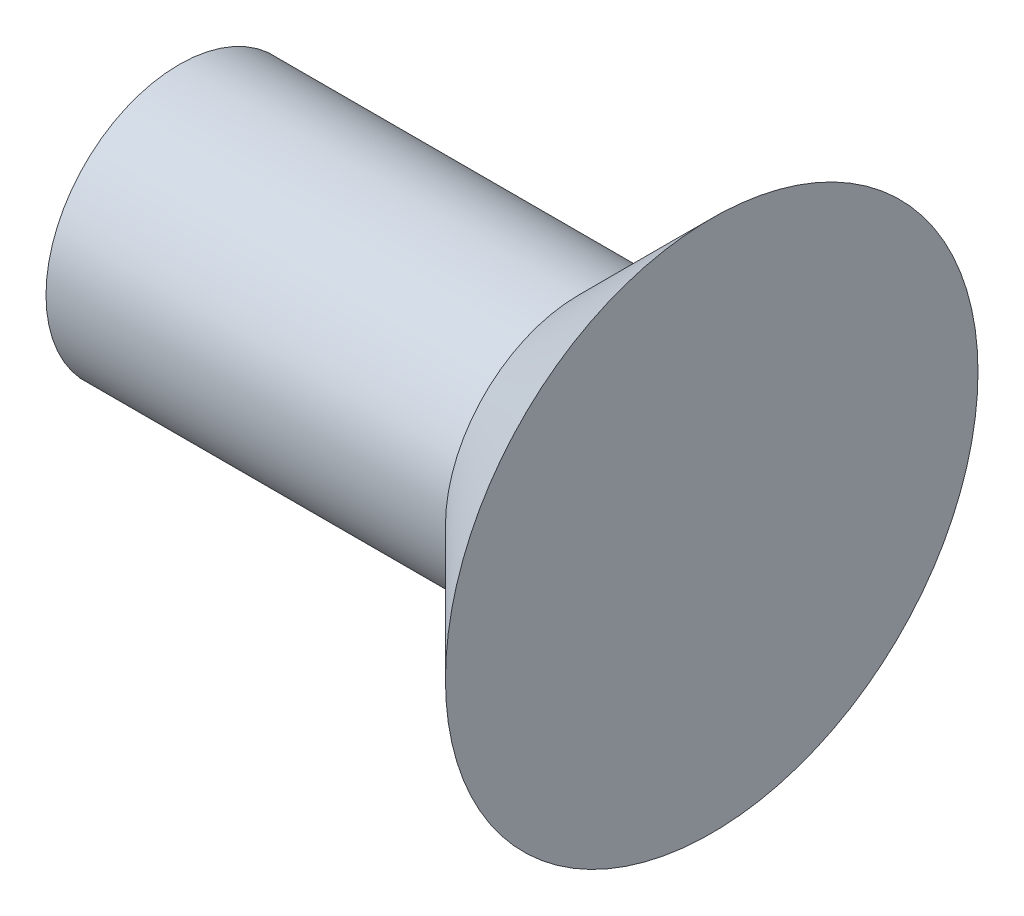
from build123d import *

# Parameters (mm, degrees)
M3_FIXING_SHANK_SKETCH_R = 1.5
M3_FIXING_SHANK_DEPTH    = 4.5


with BuildPart() as part:
    # M3 fixing shank sketch → M3 fixing shank (new body)
    with BuildSketch(Plane(origin=(54.2, 0, 0), x_dir=(0, 0, -1), z_dir=(1, 0, 0))):
        with Locations((28, -18.5)):
            Circle(M3_FIXING_SHANK_SKETCH_R)
    extrude(amount=M3_FIXING_SHANK_DEPTH)

    # Countersunk screw head profile → Countersunk screw head (revolve)
    with BuildSketch(Plane(origin=(0, 0, -28), x_dir=(-1, 0, 0), z_dir=(0, 0, -1)), mode=Mode.PRIVATE) as countersunk_screw_head_sk:
        Polygon((-58.7, -18.5), (-58.7, -17), (-60.2, -15.5), (-60.2, -18.5), align=None)
    revolve(countersunk_screw_head_sk.sketch.rotate(Axis((48.7, -18.5, -28), (1, 0, 0)), 270), axis=Axis((48.7, -18.5, -28), (1, 0, 0)))


solid = part.part
